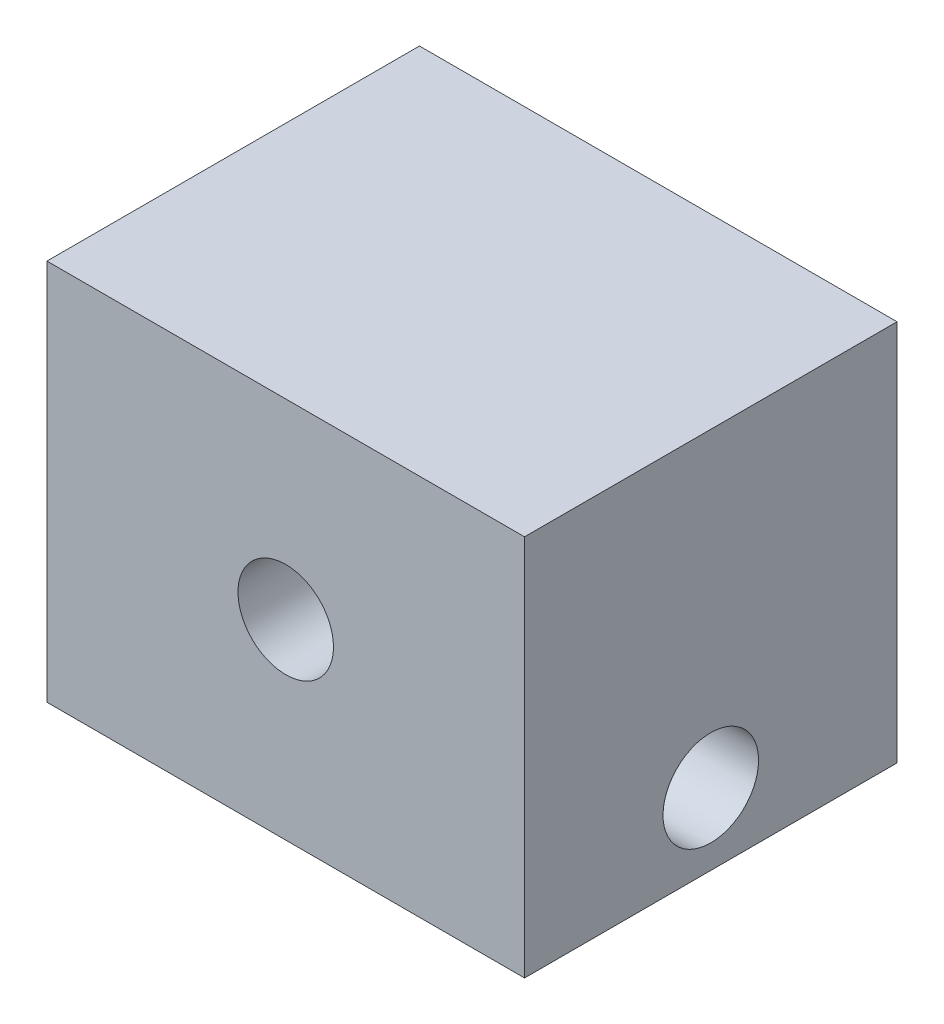
from build123d import *

# Parameters (mm, degrees)
SKETCH_1_W          = 100
SKETCH_1_H          = 80
SKETCH_1_R          = 10
EXTRUDE_1_DEPTH     = 78
CUT_EXTRUDE_1_REACH = 140.235
SKETCH_3_R          = 10


with BuildPart() as part:
    # Эскиз1 → Бобышка-Вытянуть1 (new body)
    with BuildSketch(Plane.XY):
        with Locations((0, 15)):
            Rectangle(SKETCH_1_W, SKETCH_1_H)
        with Locations((0, 15)):
            Circle(SKETCH_1_R, mode=Mode.SUBTRACT)
    extrude(amount=-EXTRUDE_1_DEPTH)

    # Эскиз3 → Вырез-Вытянуть1 (cut, up to next)
    with BuildSketch(Plane.ZY.offset(50), mode=Mode.PRIVATE) as cut_extrude_1_sk1:
        with Locations(Location((-39, -10, 0), (0, 0, 270))):
            Circle(SKETCH_3_R)
    cut_extrude_1_tool1 = extrude(cut_extrude_1_sk1.sketch, amount=-CUT_EXTRUDE_1_REACH, mode=Mode.PRIVATE) & part.part
    add(cut_extrude_1_tool1.solids().sort_by_distance((-50, -10, -39))[0], mode=Mode.SUBTRACT)


solid = part.part
